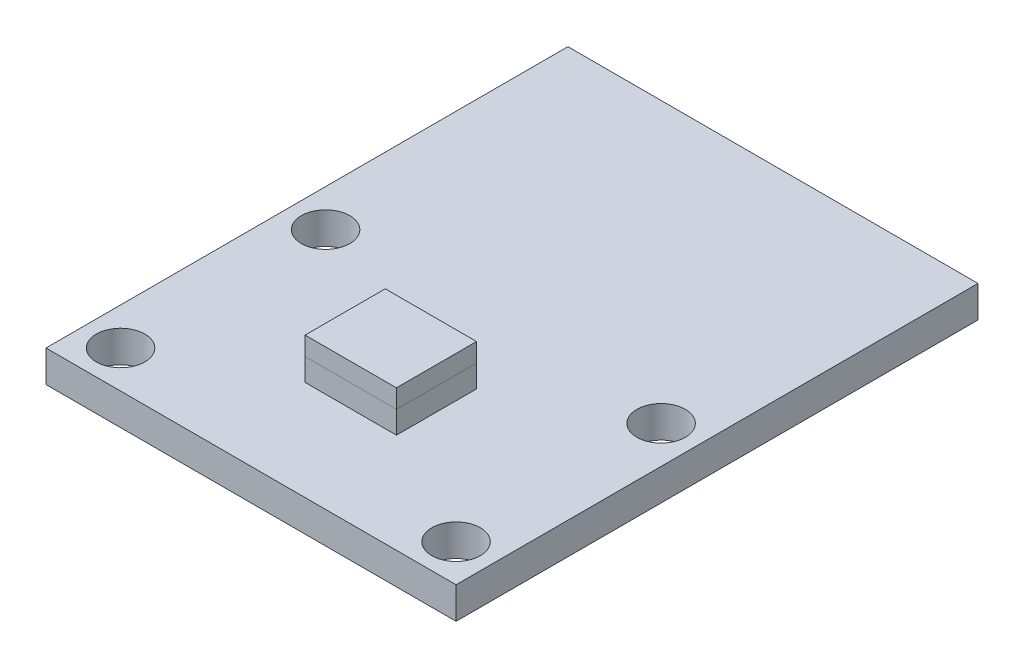
from build123d import *

# Parameters (mm, degrees)
SKETCH1_W           = 22
SKETCH1_H           = 28
SKETCH1_R           = 1.3
BOSS_EXTRUDE1_DEPTH = 1.7
SKETCH2_W           = 4.9
SKETCH2_H           = 4.3
BOSS_EXTRUDE2_DEPTH = 1.2
SKETCH3_W           = 4.9
SKETCH3_H           = 4.3
BOSS_EXTRUDE3_DEPTH = 1


with BuildPart() as part:
    # Sketch1 → Boss-Extrude1 (new body)
    with BuildSketch(Plane(origin=(0, 0, 0), x_dir=(1, 0, 0), z_dir=(0, 1, 0))):
        with Locations((0, 6.5)):
            Rectangle(SKETCH1_W, SKETCH1_H)
        with Locations(Location((-9, -5.5, 0), (0, 0, 270))):
            Circle(SKETCH1_R, mode=Mode.SUBTRACT)
        with Locations(Location((9, -5.5, 0), (0, 0, 270))):
            Circle(SKETCH1_R, mode=Mode.SUBTRACT)
        with Locations(Location((9, 5.5, 0), (0, 0, 270))):
            Circle(SKETCH1_R, mode=Mode.SUBTRACT)
        with Locations(Location((-9, 5.5, 0), (0, 0, 270))):
            Circle(SKETCH1_R, mode=Mode.SUBTRACT)
    extrude(amount=BOSS_EXTRUDE1_DEPTH)

    # Sketch2 → Boss-Extrude2 (add)
    with BuildSketch(Plane(origin=(0, 1.7, 0), x_dir=(1, 0, 0), z_dir=(0, 1, 0))):
        Rectangle(SKETCH2_W, SKETCH2_H)
    extrude(amount=BOSS_EXTRUDE2_DEPTH)


with BuildPart() as body_2:
    # Sketch3 → Boss-Extrude3 (new body)
    with BuildSketch(Plane(origin=(0, 2.9, 0), x_dir=(1, 0, 0), z_dir=(0, 1, 0))):
        Rectangle(SKETCH3_W, SKETCH3_H)
    extrude(amount=BOSS_EXTRUDE3_DEPTH)


solid = Compound([part.part, body_2.part])
